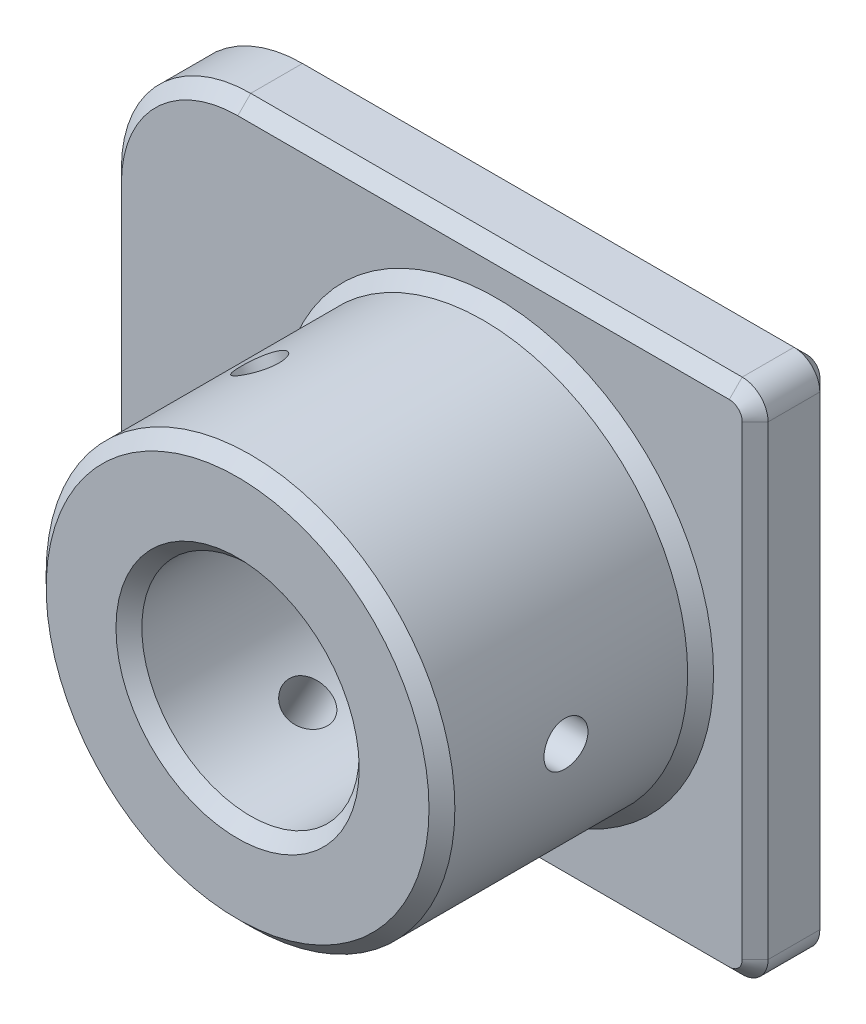
from build123d import *

# Parameters (mm, degrees)
SKETCH1_R                      = 0.005
BOSS_EXTRUDE1_DEPTH            = 0.003
SKETCH2_R                      = 0.0079
SKETCH2_R_2                    = 0.004201919
BOSS_EXTRUDE3_DEPTH            = 0.01
CHAMFER1_SIZE                  = 0.0005
CUT_EXTRUDE1_REACH             = 2.054
SKETCH3_R                      = 0.00085
CUT_EXTRUDE1_DIRECTION_2_DEPTH = 1.053763073
CIRPATTERN1_COUNT              = 3


with BuildPart() as part:
    # Sketch1 → Boss-Extrude1 (new body)
    with BuildSketch(Plane.XY):
        with BuildLine():
            Line((0.009008368, -0.025787204), (-0.009991632, -0.025787204))
            ThreePointArc((-0.009991632, -0.025787204), (-0.013527166, -0.02725167), (-0.014991632, -0.030787204))
            Line((-0.014991632, -0.030787204), (-0.014991632, -0.040787204))
            ThreePointArc((-0.014991632, -0.040787204), (-0.013527166, -0.044322738), (-0.009991632, -0.045787204))
            Line((-0.009991632, -0.045787204), (0.009008368, -0.045787204))
            ThreePointArc((0.009008368, -0.045787204), (0.009715474, -0.045494311), (0.010008368, -0.044787204))
            Line((0.010008368, -0.044787204), (0.010008368, -0.026787204))
            ThreePointArc((0.010008368, -0.026787204), (0.009715474, -0.026080097), (0.009008368, -0.025787204))
        make_face()
        with Locations((0, -0.035787204)):
            Circle(SKETCH1_R, mode=Mode.SUBTRACT)
    extrude(amount=BOSS_EXTRUDE1_DEPTH)

    # Sketch2 → Boss-Extrude3 (add)
    with BuildSketch(Plane.XY.offset(0.003)):
        with Locations((0, -0.035787204)):
            Circle(SKETCH2_R)
        with Locations((0, -0.035787204)):
            Circle(SKETCH2_R_2, mode=Mode.SUBTRACT)
    extrude(amount=BOSS_EXTRUDE3_DEPTH)

    # Chamfer1
    chamfer1_edges = [part.edges().sort_by_distance(p)[0] for p in [
        (-0.000491632, -0.045787204, 0),
        (-0.013527166, -0.044322738, 0),
        (-0.014991632, -0.035787204, 0),
        (0.009715474, -0.045494311, 0.003),
        (-0.013527166, -0.02725167, 0),
        (-0.000491632, -0.025787204, 0),
        (0.009715474, -0.026080097, 0),
        (0.010008368, -0.035787204, 0),
        (0.009715474, -0.045494311, 0),
        (-0.005, -0.035787204, 0),
        (0.010008368, -0.035787204, 0.003),
        (0.009715474, -0.026080097, 0.003),
        (-0.000491632, -0.025787204, 0.003),
        (-0.0079, -0.035787204, 0.003),
        (-0.013527166, -0.02725167, 0.003),
        (-0.0079, -0.035787204, 0.013),
        (-0.004201919, -0.035787204, 0.013),
        (-0.014991632, -0.035787204, 0.003),
        (-0.013527166, -0.044322738, 0.003),
        (-0.000491632, -0.045787204, 0.003),
    ]]
    chamfer(chamfer1_edges, length=CHAMFER1_SIZE)

    # Sketch3 → Cut-Extrude1 (cut, up to next)
    with BuildSketch(Plane(origin=(0.010008368, 0, 0), x_dir=(0, 0, -1), z_dir=(1, 0, 0)), mode=Mode.PRIVATE) as cut_extrude1_sk1:
        with Locations(Location((-0.008204866, -0.035787204, 0), (0, 0, 90))):
            Circle(SKETCH3_R)
    cut_extrude1_tool1 = extrude(cut_extrude1_sk1.sketch, amount=-CUT_EXTRUDE1_REACH, mode=Mode.PRIVATE) & part.part
    cut_extrude1 = cut_extrude1_tool1.solids().sort_by_distance((0.010008, -0.035787, 0.008205))[0]
    add(cut_extrude1, mode=Mode.SUBTRACT)

    # Sketch3 → Cut-Extrude1 direction 2 (cut)
    with BuildSketch(Plane(origin=(0.010008368, 0, 0), x_dir=(0, 0, -1), z_dir=(1, 0, 0))):
        with Locations(Location((-0.008204866, -0.035787204, 0), (0, 0, 90))):
            Circle(SKETCH3_R)
    cut_extrude1_direction_2 = extrude(amount=CUT_EXTRUDE1_DIRECTION_2_DEPTH, mode=Mode.SUBTRACT)

    # CirPattern1: Cut-Extrude1, Cut-Extrude1 direction 2 ×3 about axis
    cirpattern1_axis = Axis((0, -0.035787204, 0.0125), (0, 0, 1))
    add([cut_extrude1.rotate(cirpattern1_axis, i * 360 / CIRPATTERN1_COUNT) for i in range(1, CIRPATTERN1_COUNT)], mode=Mode.SUBTRACT)
    add([cut_extrude1_direction_2.rotate(cirpattern1_axis, i * 360 / CIRPATTERN1_COUNT) for i in range(1, CIRPATTERN1_COUNT)], mode=Mode.SUBTRACT)


solid = part.part
